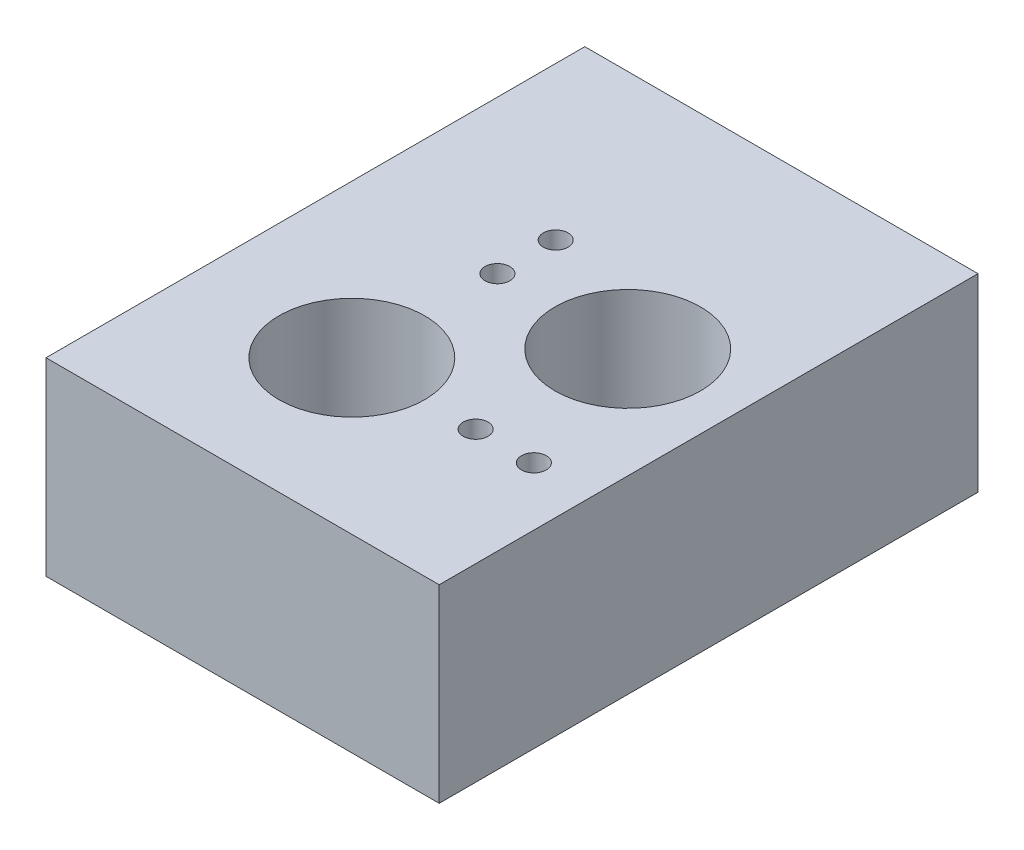
from build123d import *

# Parameters (mm, degrees)
SKETCH1_W           = 54
SKETCH1_H           = 54
BOSS_EXTRUDE1_DEPTH = 26
SKETCH2_R           = 1.70360319
SKETCH2_R_2         = 10
CUT_EXTRUDE1_DEPTH  = 47.19523785
SKETCH3_W           = 54
SKETCH3_H           = 26
BOSS_EXTRUDE2_DEPTH = 20
SKETCH4_W           = 20
SKETCH4_H           = 11
CUT_EXTRUDE2_DEPTH  = 20


with BuildPart() as part:
    # Sketch1 → Boss-Extrude1 (new body)
    with BuildSketch(Plane(origin=(0, 0, 0), x_dir=(1, 0, 0), z_dir=(0, 1, 0))):
        Rectangle(SKETCH1_W, SKETCH1_H)
    extrude(amount=BOSS_EXTRUDE1_DEPTH)

    # Sketch2 → Cut-Extrude1 (cut, through all)
    with BuildSketch(Plane(origin=(0, 26, 0), x_dir=(1, 0, 0), z_dir=(0, 1, 0))):
        with Locations(Location((-6, 22, 0), (0, 0, 270))):
            Circle(SKETCH2_R)
        with Locations(Location((-6, 14, 0), (0, 0, 270))):
            Circle(SKETCH2_R)
        with Locations(Location((19, -5.996588382, 0), (0, 0, 270))):
            Circle(SKETCH2_R)
        with Locations(Location((11, -5.996588382, 0), (0, 0, 270))):
            Circle(SKETCH2_R)
        with Locations(Location((11.896457598, 14, 0), (0, 0, 270))):
            Circle(SKETCH2_R_2)
        with Locations(Location((-6, -5.996588382, 0), (0, 0, 270))):
            Circle(SKETCH2_R_2)
    extrude(amount=-CUT_EXTRUDE1_DEPTH, mode=Mode.SUBTRACT)

    # Sketch3 → Boss-Extrude2 (add)
    with BuildSketch(Plane(origin=(0, 0, -27), x_dir=(-1, 0, 0), z_dir=(0, 0, -1))):
        with Locations((0, 13)):
            Rectangle(SKETCH3_W, SKETCH3_H)
    extrude(amount=BOSS_EXTRUDE2_DEPTH)

    # Sketch4 → Cut-Extrude2 (cut)
    with BuildSketch(Plane(origin=(0, 0, -47), x_dir=(-1, 0, 0), z_dir=(0, 0, -1))):
        with Locations((6, 11.5)):
            Rectangle(SKETCH4_W, SKETCH4_H)
    extrude(amount=-CUT_EXTRUDE2_DEPTH, mode=Mode.SUBTRACT)


solid = part.part
